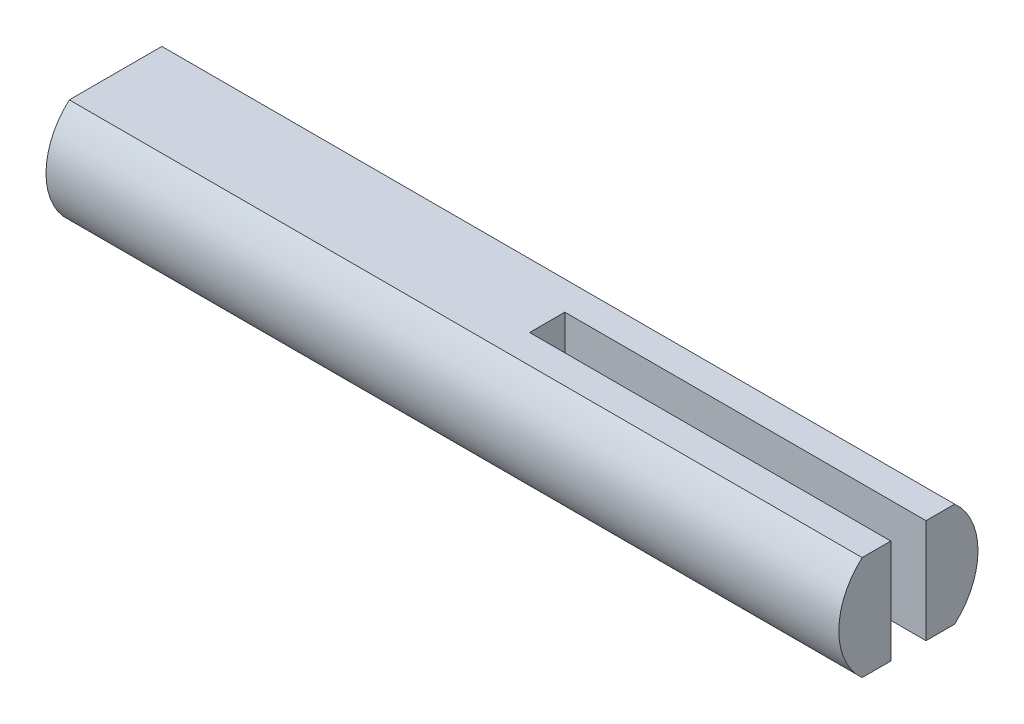
from build123d import *

# Parameters (mm, degrees)
BOSS_EXTRUDE1_DEPTH      = 40.5
BOSS_EXTRUDE1_DEPTH_BACK = 4.5
CUT_EXTRUDE2_DEPTH       = 42.117666519


with BuildPart() as part:
    # Sketch1 → Boss-Extrude1 (new, two sides: drawn at the far end of the back side and taken through both)
    with BuildSketch(Plane(origin=(0, 0, 0), x_dir=(0, 0, -1), z_dir=(1, 0, 0)).offset(-BOSS_EXTRUDE1_DEPTH_BACK)):
        with BuildLine():
            Line((-2.626785107, 2.95), (2.626785107, 2.95))
            ThreePointArc((2.626785107, 2.95), (3.95, 0), (2.626785107, -2.95))
            Line((2.626785107, -2.95), (-2.626785107, -2.95))
            ThreePointArc((-2.626785107, -2.95), (-3.95, 0), (-2.626785107, 2.95))
        make_face()
    extrude(amount=BOSS_EXTRUDE1_DEPTH + BOSS_EXTRUDE1_DEPTH_BACK)

    # Sketch5 → Cut-Extrude2 (cut, through all)
    with BuildSketch(Plane(origin=(0, 2.95, 0), x_dir=(1, 0, 0), z_dir=(0, 1, 0))):
        Polygon((40.5, 0), (40.5, 1), (20, 1), (20, -1), (40.5, -1), align=None)
    extrude(amount=-CUT_EXTRUDE2_DEPTH, mode=Mode.SUBTRACT)


solid = part.part
